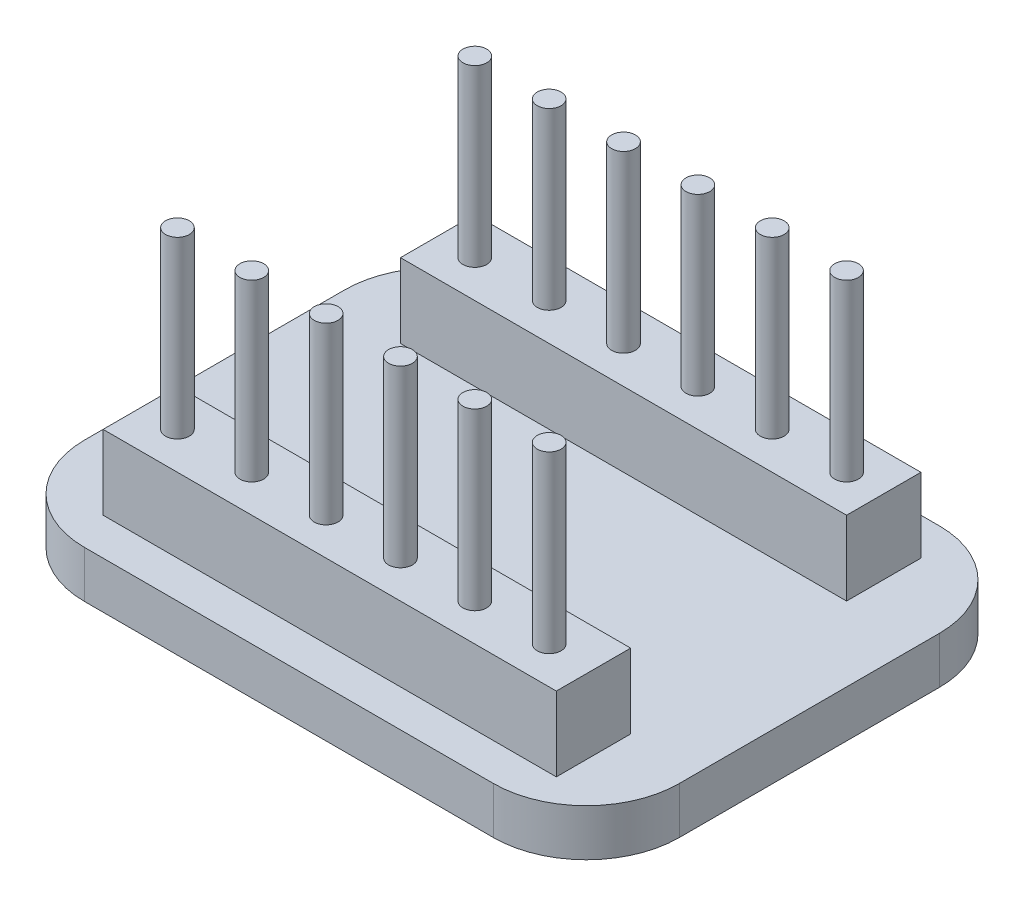
from build123d import *

# Parameters (mm, degrees)
BOSS_EXTRUDE1_DEPTH = 1.6002
SKETCH2_R           = 0.508
CUT_EXTRUDE1_DEPTH  = 13.80041562
LPATTERN1_COUNT     = 6
LPATTERN1_PITCH     = 2.54
SKETCH3_W           = 15.24
SKETCH3_H           = 2.54
SKETCH3_W_2         = 15.484150469
BOSS_EXTRUDE2_DEPTH = 2.54
SKETCH4_R           = 0.4064
BOSS_EXTRUDE3_DEPTH = 5.969
LPATTERN2_COUNT     = 6
LPATTERN2_PITCH     = 2.54


with BuildPart() as part:
    # Sketch1 → Boss-Extrude1 (new body)
    with BuildSketch(Plane(origin=(0, 0, 0), x_dir=(1, 0, 0), z_dir=(0, 1, 0))):
        with BuildLine():
            Line((-6.985, -7.62), (6.985, -7.62))
            ThreePointArc((6.985, -7.62), (9.23006403, -6.69006403), (10.16, -4.445))
            Line((10.16, -4.445), (10.16, 4.445))
            ThreePointArc((10.16, 4.445), (9.23006403, 6.69006403), (6.985, 7.62))
            Line((6.985, 7.62), (-6.985, 7.62))
            ThreePointArc((-6.985, 7.62), (-9.23006403, 6.69006403), (-10.16, 4.445))
            Line((-10.16, 4.445), (-10.16, -4.445))
            ThreePointArc((-10.16, -4.445), (-9.23006403, -6.69006403), (-6.985, -7.62))
        make_face()
    extrude(amount=BOSS_EXTRUDE1_DEPTH)

    # Sketch2 → Cut-Extrude1 (cut, symmetric)
    with BuildSketch(Plane(origin=(0, 1.6002, 0), x_dir=(1, 0, 0), z_dir=(0, 1, 0))):
        with Locations(Location((-6.35, 5.08, 0), (0, 0, 270))):
            Circle(SKETCH2_R)
        with Locations(Location((-6.35, -5.08, 0), (0, 0, 270))):
            Circle(SKETCH2_R)
    cut_extrude1 = extrude(amount=CUT_EXTRUDE1_DEPTH, both=True, mode=Mode.SUBTRACT)

    # LPattern1: Cut-Extrude1 ×6
    with Locations(*[(i * LPATTERN1_PITCH, 0, 0) for i in range(1, LPATTERN1_COUNT)]):
        add(cut_extrude1, mode=Mode.SUBTRACT)

    # Sketch3 → Boss-Extrude2 (add)
    with BuildSketch(Plane(origin=(0, 1.6002, 0), x_dir=(1, 0, 0), z_dir=(0, 1, 0))):
        with Locations((0, 5.08)):
            Rectangle(SKETCH3_W, SKETCH3_H)
        with Locations((0.122075235, -5.08)):
            Rectangle(SKETCH3_W_2, SKETCH3_H)
    extrude(amount=BOSS_EXTRUDE2_DEPTH)

    # Sketch4 → Boss-Extrude3 (add)
    with BuildSketch(Plane(origin=(0, 4.1402, 0), x_dir=(1, 0, 0), z_dir=(0, 1, 0))):
        with Locations(Location((-6.35, 5.08, 0), (0, 0, 270))):
            Circle(SKETCH4_R)
        with Locations(Location((-6.35, -5.08, 0), (0, 0, 270))):
            Circle(SKETCH4_R)
    boss_extrude3 = extrude(amount=BOSS_EXTRUDE3_DEPTH)

    # LPattern2: Boss-Extrude3 ×6
    with Locations(*[(i * LPATTERN2_PITCH, 0, 0) for i in range(1, LPATTERN2_COUNT)]):
        add(boss_extrude3)


solid = part.part
